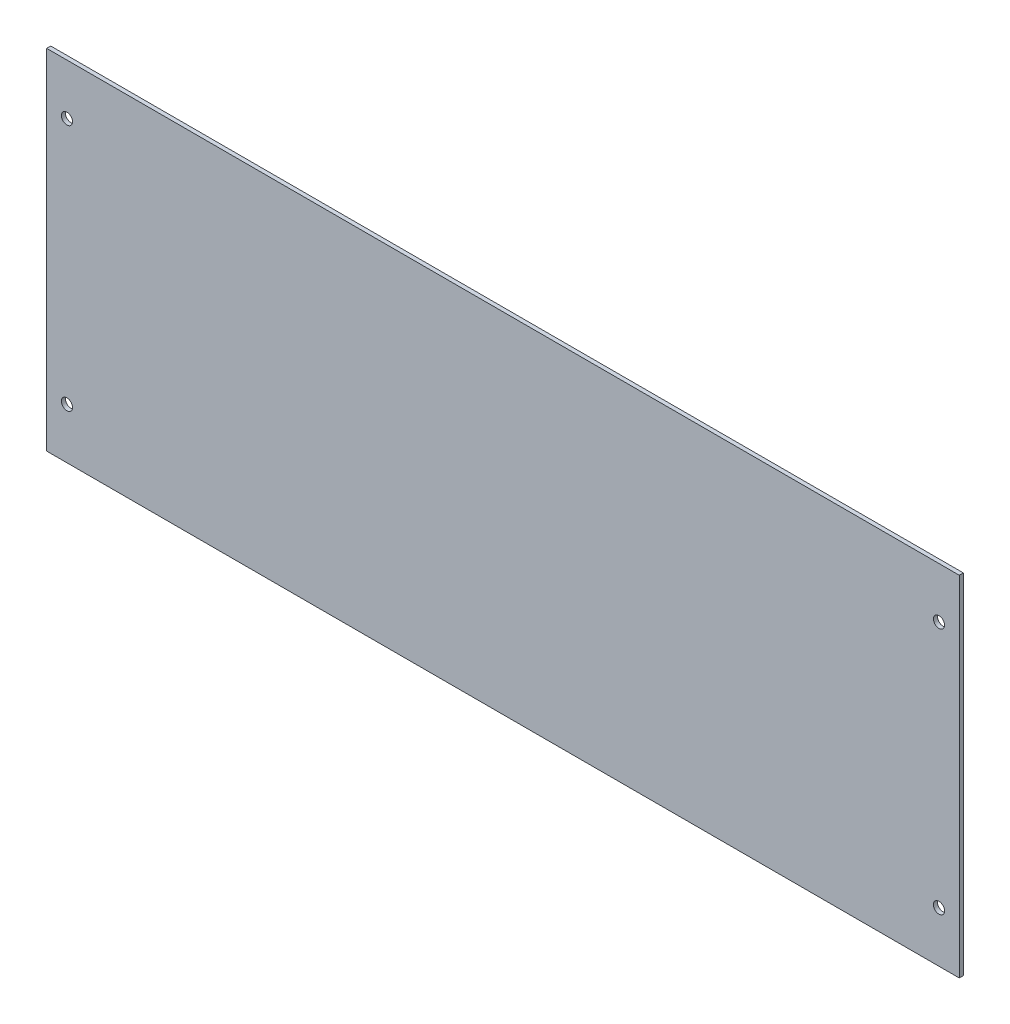
from build123d import *

# Parameters (mm, degrees)
SKETCH1_W           = 450
SKETCH1_H           = 172
BOSS_EXTRUDE1_DEPTH = 2
SKETCH2_R           = 2.75
CUT_EXTRUDE1_DEPTH  = 241.883789409


with BuildPart() as part:
    # Sketch1 → Boss-Extrude1 (new body)
    with BuildSketch(Plane.XY):
        Rectangle(SKETCH1_W, SKETCH1_H)
    extrude(amount=BOSS_EXTRUDE1_DEPTH)

    # Sketch2 → Cut-Extrude1 (cut, through all)
    with BuildSketch(Plane.XY.offset(2)):
        with Locations((-215, 61)):
            Circle(SKETCH2_R)
        with Locations((215, 61)):
            Circle(SKETCH2_R)
        with Locations((215, -61)):
            Circle(SKETCH2_R)
        with Locations((-215, -61)):
            Circle(SKETCH2_R)
    extrude(amount=-CUT_EXTRUDE1_DEPTH, mode=Mode.SUBTRACT)


solid = part.part
